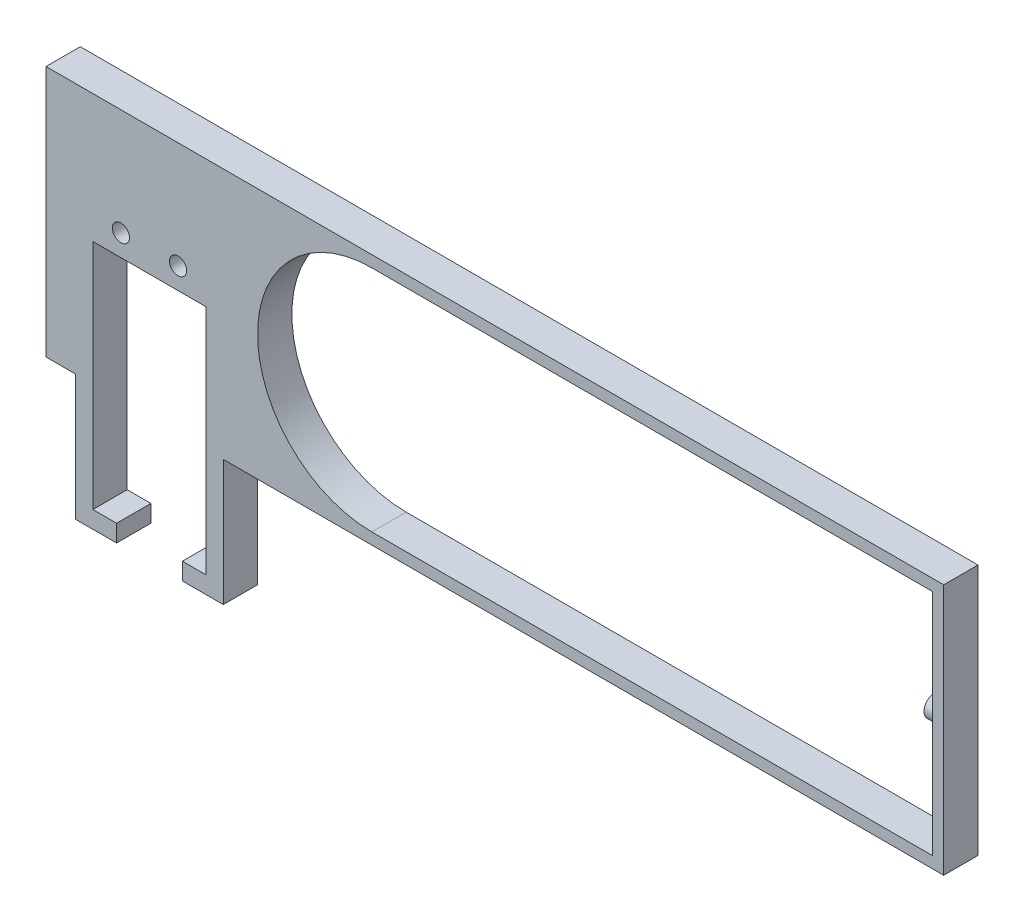
from build123d import *

# Parameters (mm, degrees)
SKETCH1_R           = 1.5
BOSS_EXTRUDE1_DEPTH = 6
SKETCH2_R           = 1.905
BOSS_EXTRUDE2_DEPTH = 2.54


with BuildPart() as part:
    # Sketch1 → Boss-Extrude1 (new body)
    with BuildSketch(Plane.XY):
        Polygon((0, 0), (100, 0), (100, 44), (0, 44), (-57, 44), (-57, 0), (-51.8, 0), (-51.8, -22), (-44.65, -22), (-44.65, -19), (-48.8, -19), (-48.8, 21.6), (-29, 21.6), (-29, -19), (-33.15, -19), (-33.15, -22), (-26, -22), (-26, 0), align=None)
        with Locations((-43.9, 25.353)):
            Circle(SKETCH1_R, mode=Mode.SUBTRACT)
        with Locations((-33.9, 25.353)):
            Circle(SKETCH1_R, mode=Mode.SUBTRACT)
        with BuildLine():
            Line((0, 2), (98, 2))
            Line((98, 2), (98, 42))
            Line((98, 42), (0, 42))
            ThreePointArc((0, 42), (-20, 22), (0, 2))
        make_face(mode=Mode.SUBTRACT)
    extrude(amount=BOSS_EXTRUDE1_DEPTH)

    # Sketch2 → Boss-Extrude2 (add)
    with BuildSketch(Plane.ZY.offset(-98)):
        with Locations((3, 22)):
            Circle(SKETCH2_R)
    extrude(amount=BOSS_EXTRUDE2_DEPTH)


solid = part.part
